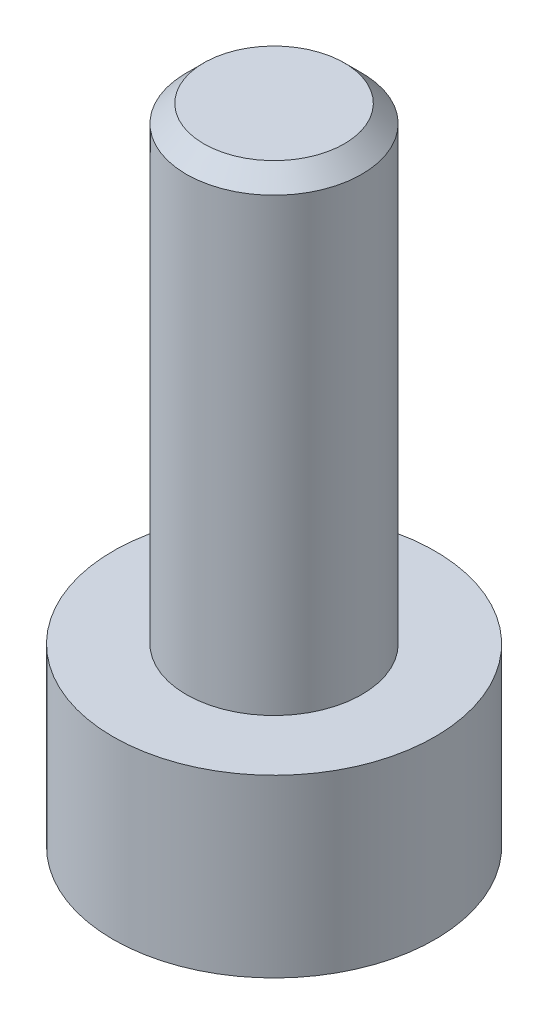
from build123d import *

# Parameters (mm, degrees)
SKETCH_1_R          = 2.75
EXTRUDE_1_DEPTH     = 3
CUT_EXTRUDE_1_DEPTH = 1.5
SKETCH_2_R          = 1.5
EXTRUDE_2_DEPTH     = 8
CHAMFER_1_SIZE      = 0.3
SCALE_1_SCALE       = 2


with BuildPart() as part:
    # 草图1 → 凸台-拉伸1 (new body)
    with BuildSketch(Plane(origin=(0, 0, 0), x_dir=(1, 0, 0), z_dir=(0, 1, 0))):
        with Locations(Location((0, 0, 0), (0, 0, 270))):
            Circle(SKETCH_1_R)
    extrude(amount=EXTRUDE_1_DEPTH)

    # 草图3 → 切除-拉伸1 (cut)
    with BuildSketch(Plane.XZ):
        Polygon((0, 1.25), (-1.082531755, 0.625), (-1.082531755, -0.625), (0, -1.25), (1.082531755, -0.625), (1.082531755, 0.625), align=None)
    extrude(amount=-CUT_EXTRUDE_1_DEPTH, mode=Mode.SUBTRACT)

    # 草图2 → 凸台-拉伸2 (add)
    with BuildSketch(Plane(origin=(0, 3, 0), x_dir=(1, 0, 0), z_dir=(0, 1, 0))):
        with Locations(Location((0, 0, 0), (0, 0, 270))):
            Circle(SKETCH_2_R)
    extrude(amount=EXTRUDE_2_DEPTH)

    # 倒角1
    chamfer_1_edges = [part.edges().sort_by_distance(p)[0] for p in [
        (0, 11, -1.5),
    ]]
    chamfer(chamfer_1_edges, length=CHAMFER_1_SIZE)


with BuildPart() as part_1:
    # 缩放比例1: scaled about (0, 4.07020226, 0)
    add(part.part.scale(SCALE_1_SCALE).moved(Location((0, -4.07020226, 0))))


solid = part_1.part
